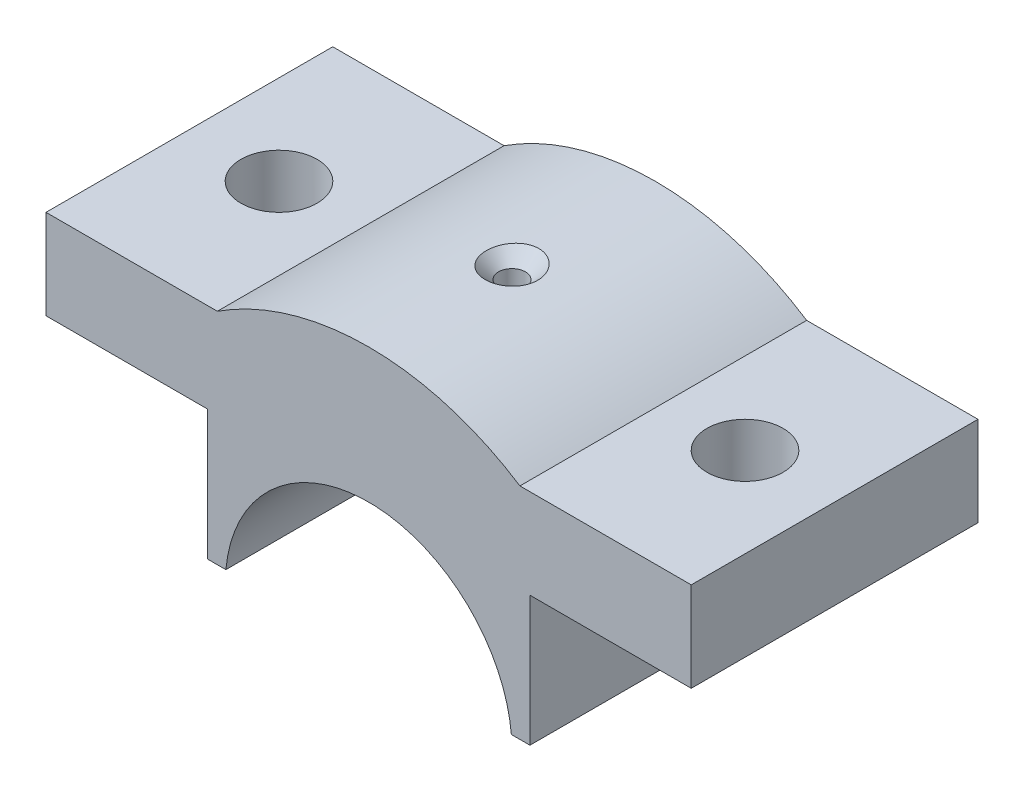
from build123d import *

# Parameters (mm, degrees)
BOSS_EXTRUDE1_DEPTH = 64
SKETCH2_R           = 8.5
CUT_EXTRUDE1_DEPTH  = 109.081263889
SKETCH3_R           = 3
CUT_EXTRUDE2_DEPTH  = 113.967073095
SKETCH4_R           = 6
CUT_EXTRUDE3_DEPTH  = 3
CUT_EXTRUDE3_DRAFT  = -45


with BuildPart() as part:
    # Sketch1 → Boss-Extrude1 (new body)
    with BuildSketch(Plane.XY):
        with BuildLine():
            Line((-33.763886032, 52), (-72.003886032, 52))
            Line((-72.003886032, 52), (-72.003886032, 32))
            Line((-72.003886032, 32), (-36.003886032, 32))
            Line((-36.003886032, 32), (-36.003886032, 3))
            Line((-36.003886032, 3), (-31.863886032, 3))
            ThreePointArc((-31.863886032, 3), (0, 32.004800157), (31.863886032, 3))
            Line((31.863886032, 3), (36.003886032, 3))
            Line((36.003886032, 3), (36.003886032, 32))
            Line((36.003886032, 32), (72.003886032, 32))
            Line((72.003886032, 32), (72.003886032, 52))
            Line((72.003886032, 52), (33.763886032, 52))
            ThreePointArc((33.763886032, 52), (0, 62), (-33.763886032, 52))
        make_face()
    extrude(amount=BOSS_EXTRUDE1_DEPTH)

    # Sketch2 → Cut-Extrude1 (cut, through all)
    with BuildSketch(Plane(origin=(0, 52, 0), x_dir=(1, 0, 0), z_dir=(0, 1, 0))):
        with Locations(Location((-52.003886032, -32, 0), (0, 0, 180))):
            Circle(SKETCH2_R)
    cut_extrude1 = extrude(amount=-CUT_EXTRUDE1_DEPTH, mode=Mode.SUBTRACT)

    # Mirror1: Cut-Extrude1 across plane
    add(cut_extrude1.mirror(Plane(origin=(0, 0, 0), x_dir=(0, 0, 1), z_dir=(1, 0, 0))), mode=Mode.SUBTRACT)

    # Sketch3 → Cut-Extrude2 (cut, through all)
    with BuildSketch(Plane(origin=(0, 62, 0), x_dir=(1, 0, 0), z_dir=(0, 1, 0))):
        with Locations(Location((0, -32, 0), (0, 0, 270))):
            Circle(SKETCH3_R)
    extrude(amount=-CUT_EXTRUDE2_DEPTH, mode=Mode.SUBTRACT)


with BuildPart() as cut_extrude3_tool:
    # Sketch4 → Cut-Extrude3 (with draft: the straight prism first)
    with BuildSketch(Plane(origin=(0, 62, 0), x_dir=(1, 0, 0), z_dir=(0, 1, 0))):
        with Locations((0, -32)):
            Circle(SKETCH4_R)
    extrude(amount=-CUT_EXTRUDE3_DEPTH)
    # Cut-Extrude3: the draft: its side faces are tilted about the plane it starts from
    cut_extrude3_sides = [cut_extrude3_tool.faces().sort_by_distance(p)[0] for p in [
        (-6, 60.5, 32),
    ]]
    draft(cut_extrude3_sides, Plane(origin=(0, 62, 0), x_dir=(1, 0, 0), z_dir=(0, 1, 0)), CUT_EXTRUDE3_DRAFT)


with BuildPart() as part_1:
    add(part.part)

    # Cut-Extrude3: cut by cut_extrude3_tool
    add(cut_extrude3_tool.part, mode=Mode.SUBTRACT)


solid = part_1.part
